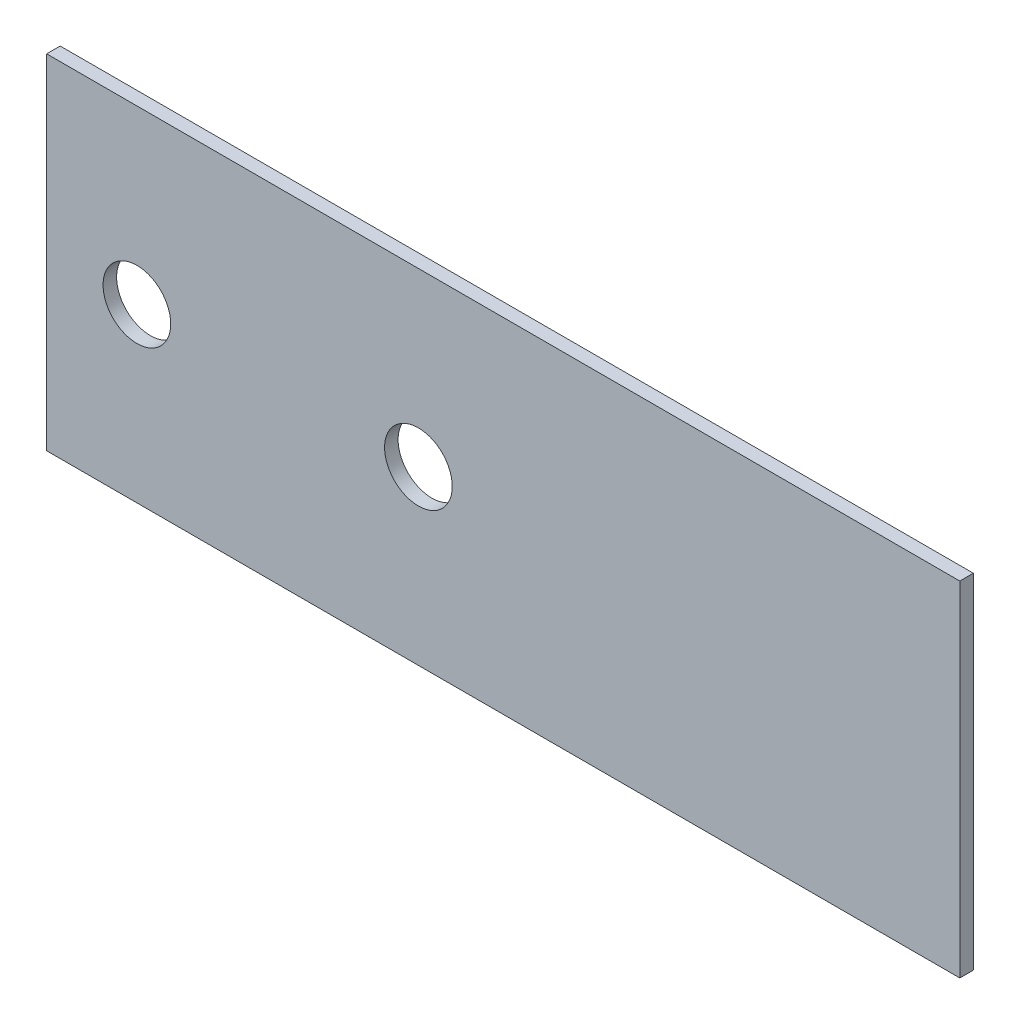
from build123d import *

# Parameters (mm, degrees)
SKETCH1_W               = 202.4
SKETCH1_H               = 76.2
BOSS_EXTRUDE1_DEPTH     = 3
SKETCH2_R               = 7.5
CUT_EXTRUDE1_DEPTH      = 109.176013977
CUT_EXTRUDE2_DEPTH      = 109.176013977
CUT_EXTRUDE2_DEPTH_BACK = 109.176013977
SKETCH3_R               = 7.5


with BuildPart() as part:
    # Sketch1 → Boss-Extrude1 (new body)
    with BuildSketch(Plane.XY):
        Rectangle(SKETCH1_W, SKETCH1_H)
    extrude(amount=BOSS_EXTRUDE1_DEPTH)

    # Sketch2 → Cut-Extrude1 (cut, through all)
    with BuildSketch(Plane.XY.offset(3)):
        with Locations((-81.2, 0)):
            Circle(SKETCH2_R)
    extrude(amount=-CUT_EXTRUDE1_DEPTH, mode=Mode.SUBTRACT)

    # Sketch3 → Cut-Extrude2 (cut, two sides: drawn at the far end of the back side and taken through both)
    with BuildSketch(Plane.XY.offset(3).offset(-CUT_EXTRUDE2_DEPTH_BACK)):
        with Locations((-18.8, 0)):
            Circle(SKETCH3_R)
    extrude(amount=CUT_EXTRUDE2_DEPTH + CUT_EXTRUDE2_DEPTH_BACK, mode=Mode.SUBTRACT)


solid = part.part
